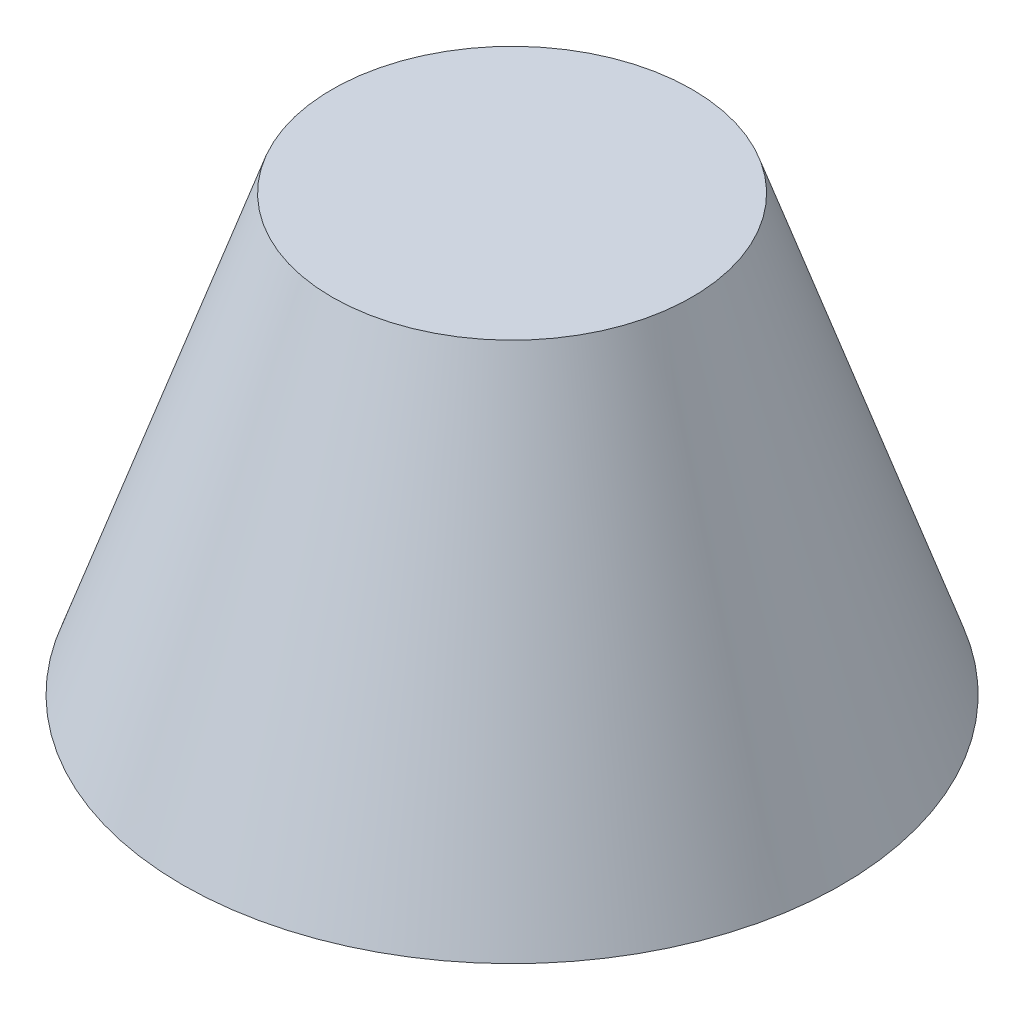
from build123d import *

# Parameters (mm, degrees)
SKETCH2_R = 37.312536059
SKETCH1_R = 68.317720137


with BuildPart() as part:
    # Sketch2 → Loft1 section 0
    with BuildSketch(Plane(origin=(0, 90, 0), x_dir=(1, 0, 0), z_dir=(0, 1, 0))):
        Circle(SKETCH2_R)
    # Sketch1 → Loft1 section 1
    with BuildSketch(Plane(origin=(0, 0, 0), x_dir=(1, 0, 0), z_dir=(0, 1, 0))):
        Circle(SKETCH1_R)
    loft()


solid = part.part
